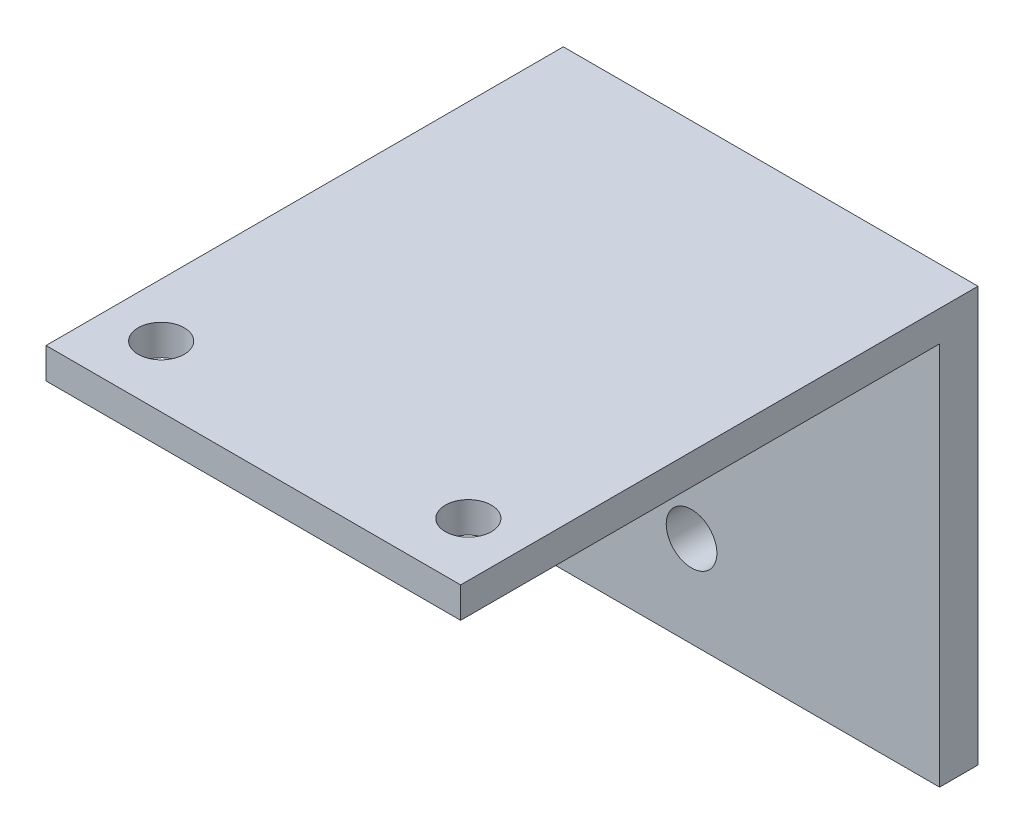
from build123d import *

# Parameters (mm, degrees)
ESQUISSE1_W             = 54
ESQUISSE1_H             = 54
BOSS_EXTRU_1_DEPTH      = 67.37
ESQUISSE2_W             = 85.887974464
ESQUISSE2_H             = 58.790343592
ENL_V_MAT_EXTRU_1_DEPTH = 62.37
ESQUISSE3_R             = 3
ENL_V_MAT_EXTRU_2_DEPTH = 62.37
D_GAGEMENT_M61_D        = 6.6


with BuildPart() as part:
    # Esquisse1 → Boss.-Extru.1 (new body)
    with BuildSketch(Plane.XY):
        Rectangle(ESQUISSE1_W, ESQUISSE1_H)
    extrude(amount=BOSS_EXTRU_1_DEPTH)

    # Esquisse2 → Enlèv. mat.-Extru.1 (cut)
    with BuildSketch(Plane.XY.offset(67.37)):
        with Locations((-4.168944697, -6.395171796)):
            Rectangle(ESQUISSE2_W, ESQUISSE2_H)
    extrude(amount=-ENL_V_MAT_EXTRU_1_DEPTH, mode=Mode.SUBTRACT)

    # Esquisse3 → Enlèv. mat.-Extru.2 (cut)
    with BuildSketch(Plane.XZ.offset(-23)):
        with Locations(Location((-20, 59.37, 0), (0, 0, 270))):
            Circle(ESQUISSE3_R)
        with Locations(Location((20, 59.37, 0), (0, 0, 270))):
            Circle(ESQUISSE3_R)
    extrude(amount=-ENL_V_MAT_EXTRU_2_DEPTH, mode=Mode.SUBTRACT)

    # Dégagement M61 (through all)
    with Locations(Plane(origin=(0, 0, 0), x_dir=(-1, 0, 0), z_dir=(0, 0, -1))):
        with Locations((5.303114898, 16.500000001), (5.303114898, -15.124467684)):
            Hole(D_GAGEMENT_M61_D / 2)


solid = part.part
